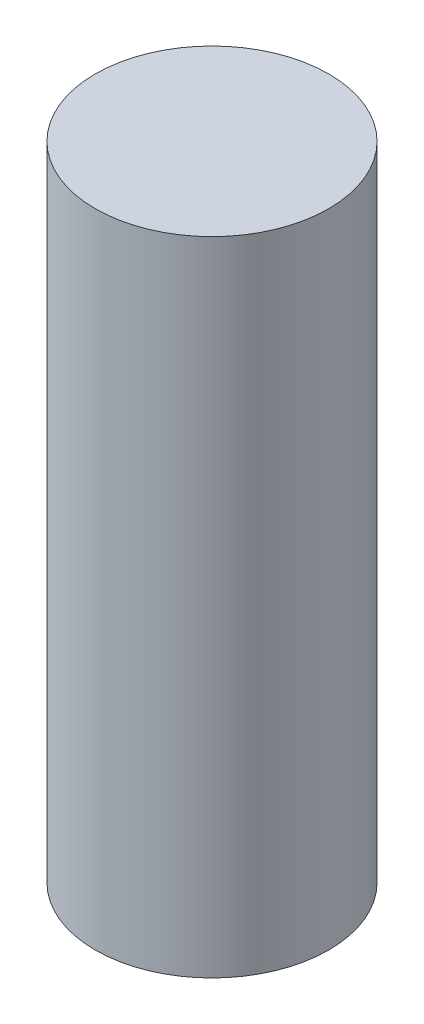
from build123d import *

# Parameters (mm, degrees)
SKETCH1_R           = 30
BOSS_EXTRUDE1_DEPTH = 165


with BuildPart() as part:
    # Sketch1 → Boss-Extrude1 (new body)
    with BuildSketch(Plane(origin=(0, 0, 0), x_dir=(1, 0, 0), z_dir=(0, 1, 0))):
        with Locations(Location((0, 0, 0), (0, 0, 270))):
            Circle(SKETCH1_R)
    extrude(amount=BOSS_EXTRUDE1_DEPTH)


solid = part.part
